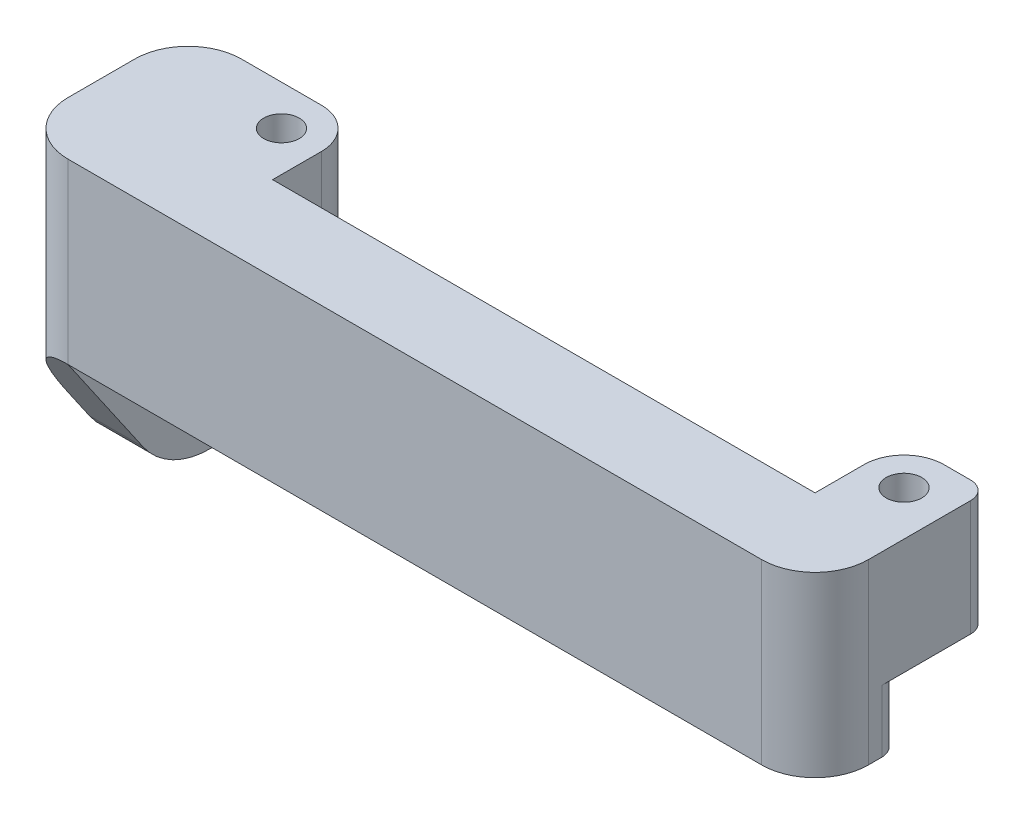
from build123d import *

# Parameters (mm, degrees)
BOSS_EXTRUDE1_DEPTH        = 3
SKETCH2_W                  = 9.75
SKETCH2_H                  = 10
BOSS_EXTRUDE2_DEPTH        = 6.75
SKETCH3_W                  = 6.75
SKETCH3_H                  = 3.5
CUT_EXTRUDE1_DEPTH         = 5
SKETCH4_W                  = 4.75
SKETCH4_H                  = 10
BOSS_EXTRUDE3_DEPTH        = 35.25
SKETCH5_W                  = 4.75
SKETCH5_H                  = 6.5
BOSS_EXTRUDE4_DEPTH        = 5
F_2_0_2_DIAMETER_HOLE1_D   = 2
F_3_2_3_2_DIAMETER_HOLE1_D = 3.2
FILLET1_R                  = 1
FILLET2_R                  = 2.25
FILLET3_R                  = 3


with BuildPart() as part:
    # Sketch1 → Boss-Extrude1 (new body)
    with BuildSketch(Plane(origin=(-25, 0, 0), x_dir=(0, -1, 0), z_dir=(-1, 0, 0))):
        with BuildLine():
            Line((-6.5, -2.25), (0, -2.25))
            Line((0, -2.25), (5.014501105, -4.64943299))
            ThreePointArc((5.014501105, -4.64943299), (10.980645857, -2.805310946), (9.610876171, 3.287258325))
            Line((9.610876171, 3.287258325), (3.5, 7.5))
            Line((3.5, 7.5), (-6.5, 7.5))
            Line((-6.5, 7.5), (-6.5, -2.25))
        make_face()
    extrude(amount=-BOSS_EXTRUDE1_DEPTH)

    # Sketch2 → Boss-Extrude2 (add)
    with BuildSketch(Plane(origin=(-22, 0, 0), x_dir=(0, 0, -1), z_dir=(1, 0, 0))):
        with Locations((-2.625, 1.5)):
            Rectangle(SKETCH2_W, SKETCH2_H)
    extrude(amount=BOSS_EXTRUDE2_DEPTH)

    # Sketch3 → Cut-Extrude1 (cut)
    with BuildSketch(Plane(origin=(0, 0, -2.25), x_dir=(-1, 0, 0), z_dir=(0, 0, -1))):
        with Locations((18.625, -1.75)):
            Rectangle(SKETCH3_W, SKETCH3_H)
    extrude(amount=-CUT_EXTRUDE1_DEPTH, mode=Mode.SUBTRACT)

    # Sketch4 → Boss-Extrude3 (add)
    with BuildSketch(Plane(origin=(-15.25, 0, 0), x_dir=(0, 0, -1), z_dir=(1, 0, 0))):
        with Locations((-5.125, 1.5)):
            Rectangle(SKETCH4_W, SKETCH4_H)
    extrude(amount=BOSS_EXTRUDE3_DEPTH)

    # Sketch5 → Boss-Extrude4 (add)
    with BuildSketch(Plane(origin=(0, 0, 2.75), x_dir=(-1, 0, 0), z_dir=(0, 0, -1))):
        with Locations((-17.625, 3.25)):
            Rectangle(SKETCH5_W, SKETCH5_H)
    extrude(amount=BOSS_EXTRUDE4_DEPTH)

    # Ø2.0 (2) Diameter Hole1 (through all)
    with Locations(Plane(origin=(0, 0, 0), x_dir=(-1, 0, 0), z_dir=(0, -1, 0))):
        with Locations((-17.5, 0), (17.5, 0)):
            Hole(F_2_0_2_DIAMETER_HOLE1_D / 2)

    # Ø3.2 (3.2) Diameter Hole1 (through all)
    with Locations(Plane(origin=(-22, 0, 0), x_dir=(0, 0, -1), z_dir=(1, 0, 0))):
        with Locations((0.5, -7)):
            Hole(F_3_2_3_2_DIAMETER_HOLE1_D / 2)

    # Fillet1
    fillet1_edges = [part.edges().sort_by_distance(p)[0] for p in [
        (20, -1.75, 2.75),
        (20, 3.25, -2.25),
    ]]
    fillet(fillet1_edges, radius=FILLET1_R)

    # Fillet2
    fillet2_edges = [part.edges().sort_by_distance(p)[0] for p in [
        (-15.25, 3.25, -2.25),
        (15.25, 3.25, -2.25),
    ]]
    fillet(fillet2_edges, radius=FILLET2_R)

    # Fillet3
    fillet3_edges = [part.edges().sort_by_distance(p)[0] for p in [
        (20, 1.5, 7.5),
        (-25, 3.25, -2.25),
        (-25, 1.5, 7.5),
    ]]
    fillet(fillet3_edges, radius=FILLET3_R)


solid = part.part
